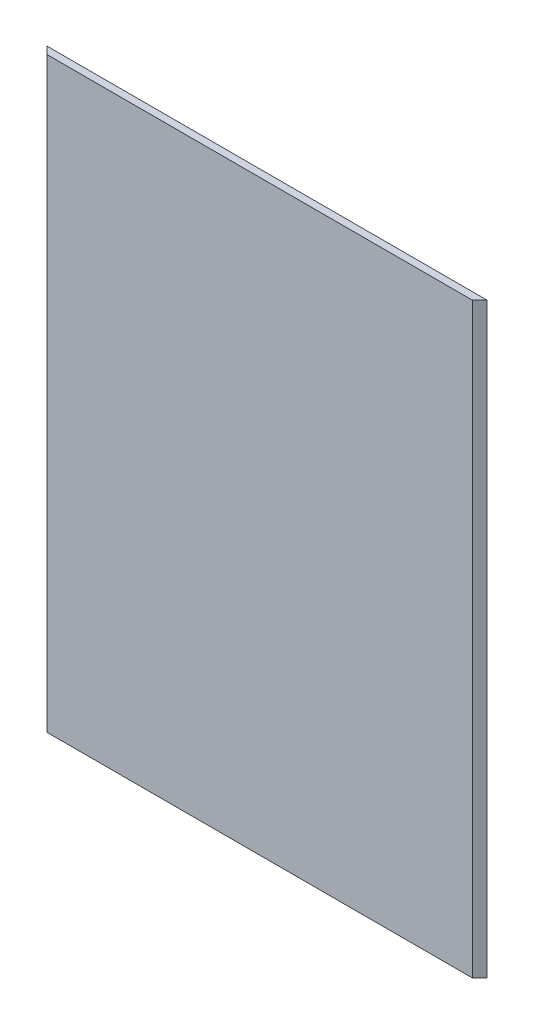
from build123d import *

# Parameters (mm, degrees)
ESQUISSE1_W             = 300
ESQUISSE1_H             = 400
BOSS_EXTRU_1_DEPTH      = 5
ENL_V_MAT_EXTRU_1_DEPTH = 428.229446551


with BuildPart() as part:
    # Esquisse1 → Boss.-Extru.1 (new body)
    with BuildSketch(Plane.XY):
        Rectangle(ESQUISSE1_W, ESQUISSE1_H)
    extrude(amount=BOSS_EXTRU_1_DEPTH)

    # Esquisse2 → Enlèv. mat.-Extru.1 (cut, through all)
    with BuildSketch(Plane(origin=(0, 200, 0), x_dir=(1, 0, 0), z_dir=(0, 1, 0))):
        Polygon((-150, -5), (-150, 0), (-145, -5), align=None)
        Polygon((145, -5), (150, -5), (150, 0), align=None)
    extrude(amount=-ENL_V_MAT_EXTRU_1_DEPTH, mode=Mode.SUBTRACT)


solid = part.part
